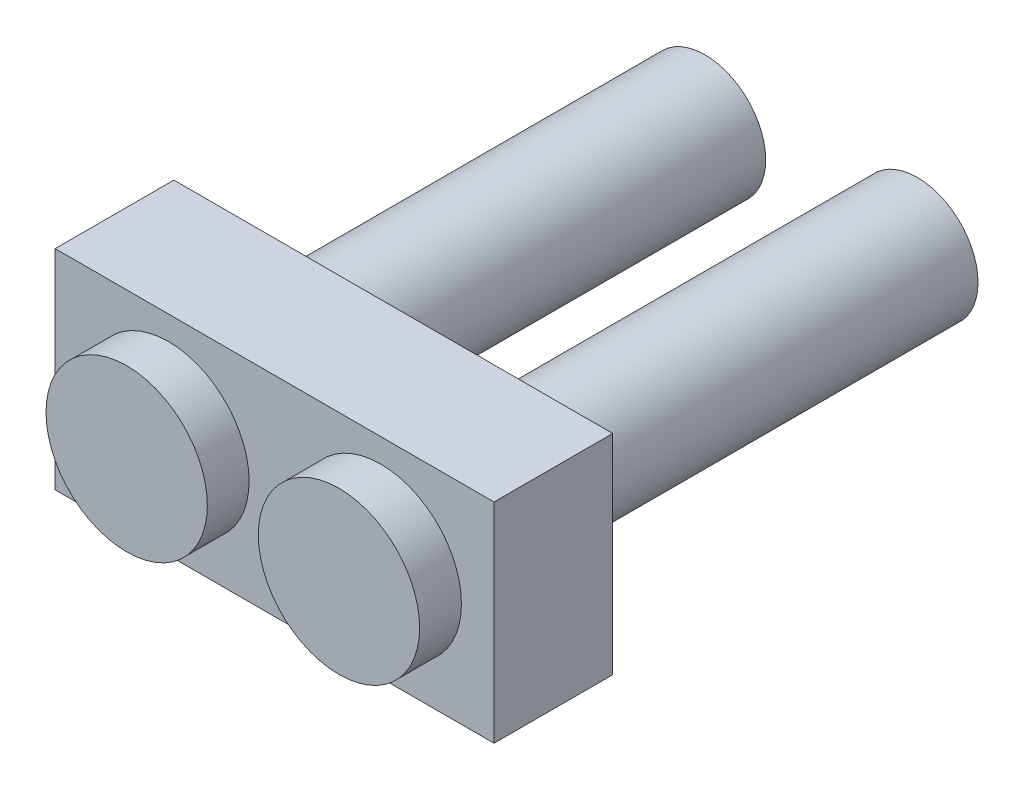
from build123d import *

# Parameters (mm, degrees)
SKETCH_1_W      = 5.25
SKETCH_1_H      = 2.5
EXTRUDE_1_DEPTH = 1.42
SKETCH_2_R      = 0.725
EXTRUDE_2_DEPTH = 5
SKETCH_3_R      = 0.965
EXTRUDE_3_DEPTH = 0.5


with BuildPart() as part:
    # ｽｹｯﾁ1 → ﾎﾞｽ - 押し出し1 (new body)
    with BuildSketch(Plane.XY):
        Rectangle(SKETCH_1_W, SKETCH_1_H)
    extrude(amount=EXTRUDE_1_DEPTH)

    # ｽｹｯﾁ2 → ﾎﾞｽ - 押し出し2 (add)
    with BuildSketch(Plane(origin=(0, 0, 0), x_dir=(-1, 0, 0), z_dir=(0, 0, -1))):
        with Locations(Location((-1.27, 0, 0), (0, 0, 180))):
            Circle(SKETCH_2_R)
        with Locations(Location((1.27, 0, 0), (0, 0, 180))):
            Circle(SKETCH_2_R)
    extrude(amount=EXTRUDE_2_DEPTH)

    # ｽｹｯﾁ3 → ﾎﾞｽ - 押し出し3 (add)
    with BuildSketch(Plane.XY.offset(1.42)):
        with Locations((-1.27, 0)):
            Circle(SKETCH_3_R)
        with Locations((1.27, 0)):
            Circle(SKETCH_3_R)
    extrude(amount=EXTRUDE_3_DEPTH)


solid = part.part
